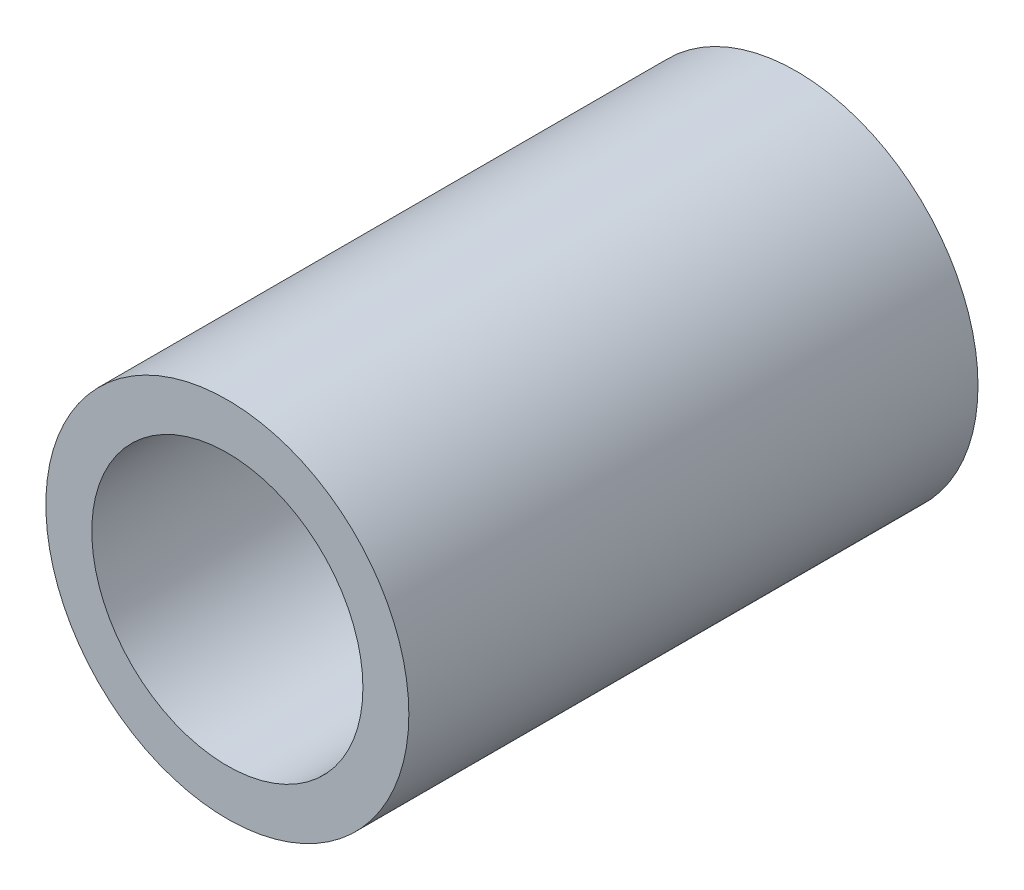
from build123d import *

# Parameters (mm, degrees)
S01_INSTALLED_BRASS_ENVELOPE_SIMPLIF_R       = 4.05
S01_INSTALLED_BRASS_ENVELOPE_SIMPLIF_R_2     = 3.025
F_01_INSTALLED_BRASS_ENVELOPE_SIMPLIFI_DEPTH = 12.7


with BuildPart() as part:
    # S01 - Installed brass envelope - simplified threads → 01 - Installed brass envelope - simplified threads (new body)
    with BuildSketch(Plane.XY):
        Circle(S01_INSTALLED_BRASS_ENVELOPE_SIMPLIF_R)
        Circle(S01_INSTALLED_BRASS_ENVELOPE_SIMPLIF_R_2, mode=Mode.SUBTRACT)
    extrude(amount=F_01_INSTALLED_BRASS_ENVELOPE_SIMPLIFI_DEPTH)


solid = part.part
